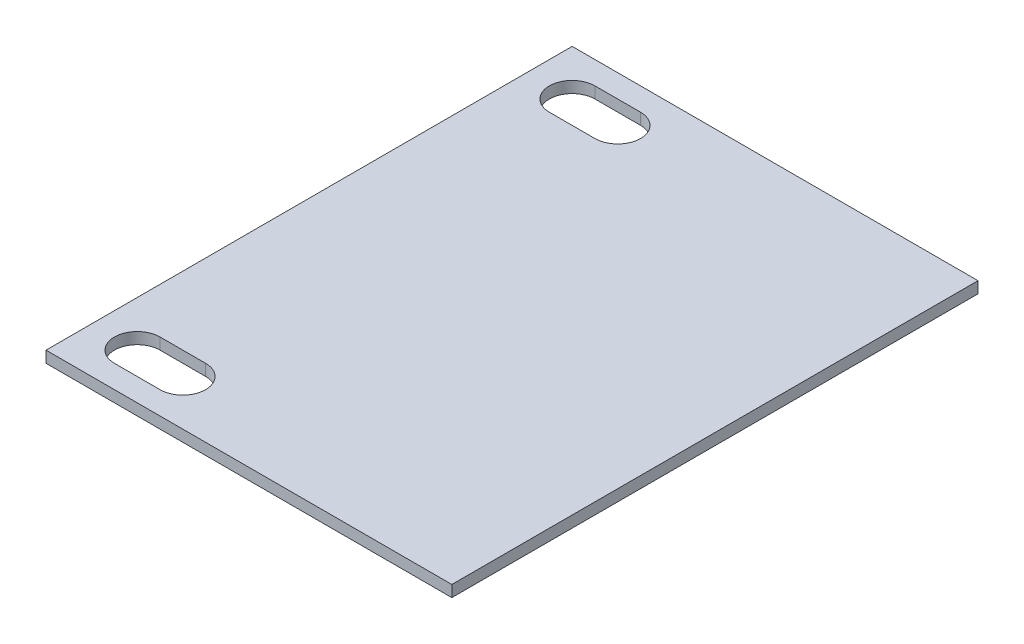
from build123d import *

# Parameters (mm, degrees)
SKETCH1_W       = 226
SKETCH1_H       = 293
MAIN_BASE_DEPTH = 3.175
HANDLES_DEPTH   = 186.12582883


with BuildPart() as part:
    # Sketch1 → Main Base (new, symmetric)
    with BuildSketch(Plane(origin=(0, 0, 0), x_dir=(1, 0, 0), z_dir=(0, 1, 0))):
        Rectangle(SKETCH1_W, SKETCH1_H)
    extrude(amount=MAIN_BASE_DEPTH, both=True)

    # Sketch2 → Handles (cut, through all)
    with BuildSketch(Plane(origin=(0, 3.175, 0), x_dir=(1, 0, 0), z_dir=(0, 1, 0))):
        with BuildLine():
            Line((-87.6, 133.8), (-62.2, 133.8))
            ThreePointArc((-62.2, 133.8), (-49.5, 121.1), (-62.2, 108.4))
            Line((-62.2, 108.4), (-87.6, 108.4))
            ThreePointArc((-87.6, 108.4), (-100.3, 121.1), (-87.6, 133.8))
        make_face()
        with BuildLine():
            Line((-87.6, -133.8), (-62.2, -133.8))
            ThreePointArc((-62.2, -133.8), (-49.5, -121.1), (-62.2, -108.4))
            Line((-62.2, -108.4), (-87.6, -108.4))
            ThreePointArc((-87.6, -108.4), (-100.3, -121.1), (-87.6, -133.8))
        make_face()
    extrude(amount=-HANDLES_DEPTH, mode=Mode.SUBTRACT)


solid = part.part
